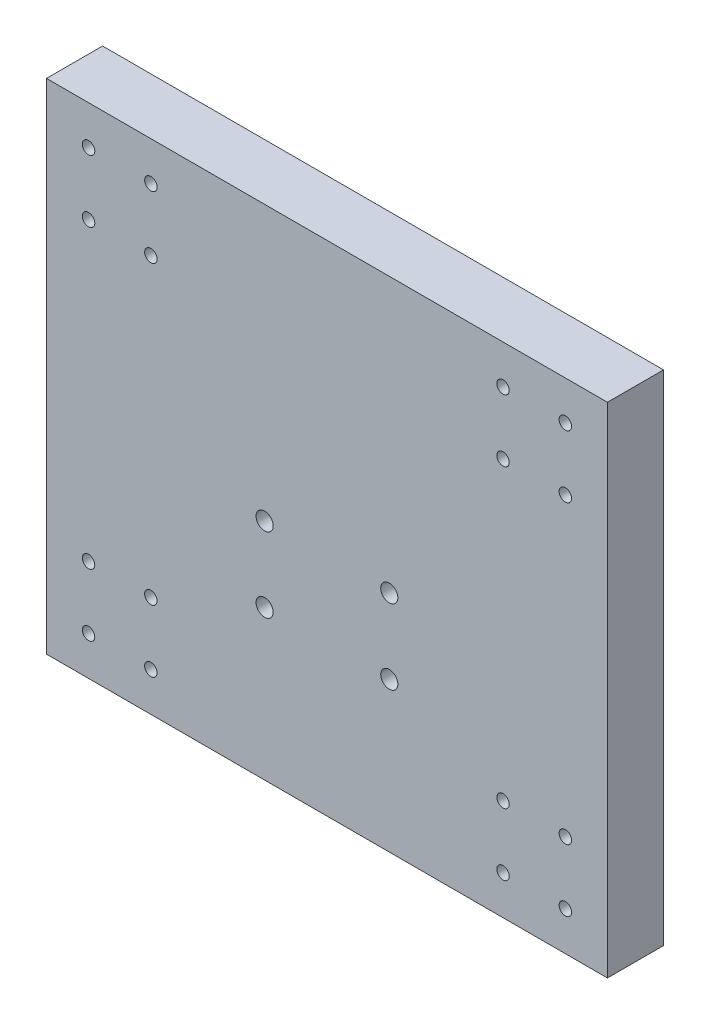
from build123d import *

# Parameters (mm, degrees)
SKETCH1_W           = 160
SKETCH1_H           = 160
BOSS_EXTRUDE1_DEPTH = 18
SKETCH3_R           = 2
CUT_EXTRUDE1_DEPTH  = 115.560027933
SKETCH4_W           = 10
SKETCH4_H           = 18
BOSS_EXTRUDE3_DEPTH = 160
SKETCH7_R           = 2.75
CUT_EXTRUDE4_DEPTH  = 122.753850042


with BuildPart() as part:
    # Sketch1 → Boss-Extrude1 (new body)
    with BuildSketch(Plane.XY):
        Rectangle(SKETCH1_W, SKETCH1_H)
    extrude(amount=-BOSS_EXTRUDE1_DEPTH)

    # Sketch3 → Cut-Extrude1 (cut, through all)
    with BuildSketch(Plane.XY):
        with Locations((-76.5, 67.5)):
            Circle(SKETCH3_R)
        with Locations((-56.5, 67.5)):
            Circle(SKETCH3_R)
        with Locations((-56.5, 47.5)):
            Circle(SKETCH3_R)
        with Locations((-76.5, 47.5)):
            Circle(SKETCH3_R)
        with Locations((76.5, 67.5)):
            Circle(SKETCH3_R)
        with Locations((76.5, 47.5)):
            Circle(SKETCH3_R)
        with Locations((76.5, -47.5)):
            Circle(SKETCH3_R)
        with Locations((76.5, -67.5)):
            Circle(SKETCH3_R)
        with Locations((56.5, -47.5)):
            Circle(SKETCH3_R)
        with Locations((56.5, -67.5)):
            Circle(SKETCH3_R)
        with Locations((-56.5, -47.5)):
            Circle(SKETCH3_R)
        with Locations((-56.5, -67.5)):
            Circle(SKETCH3_R)
        with Locations((-76.5, -47.5)):
            Circle(SKETCH3_R)
        with Locations((-76.5, -67.5)):
            Circle(SKETCH3_R)
        with Locations((56.5, 67.5)):
            Circle(SKETCH3_R)
        with Locations((56.5, 47.5)):
            Circle(SKETCH3_R)
    extrude(amount=-CUT_EXTRUDE1_DEPTH, mode=Mode.SUBTRACT)

    # Sketch4 → Boss-Extrude3 (add)
    with BuildSketch(Plane(origin=(0, 80, 0), x_dir=(1, 0, 0), z_dir=(0, 1, 0))):
        with Locations((85, 9)):
            Rectangle(SKETCH4_W, SKETCH4_H)
        with Locations((-85, 9)):
            Rectangle(SKETCH4_W, SKETCH4_H)
    extrude(amount=-BOSS_EXTRUDE3_DEPTH)

    # Sketch7 → Cut-Extrude4 (cut, through all)
    with BuildSketch(Plane(origin=(0, 0, -18), x_dir=(-1, 0, 0), z_dir=(0, 0, -1))):
        with Locations((-20, -8)):
            Circle(SKETCH7_R)
        with Locations(Location((-20, -32, 0), (0, 0, 180))):
            Circle(SKETCH7_R)
        with Locations((20, -32)):
            Circle(SKETCH7_R)
        with Locations(Location((20, -8, 0), (0, 0, 180))):
            Circle(SKETCH7_R)
    extrude(amount=-CUT_EXTRUDE4_DEPTH, mode=Mode.SUBTRACT)


solid = part.part
